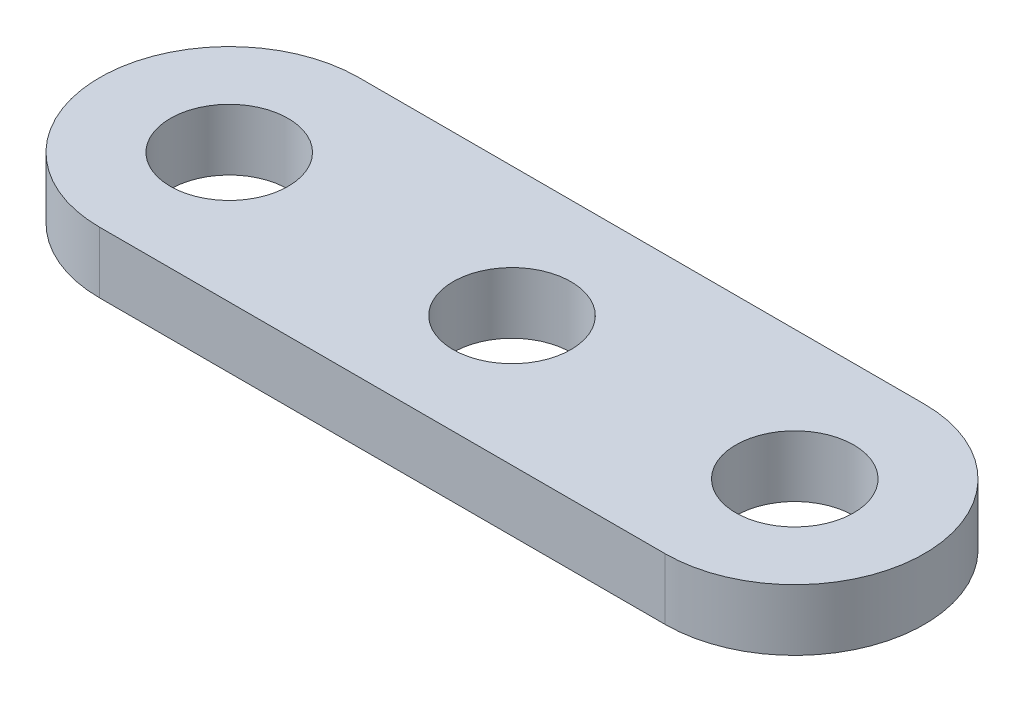
from build123d import *

# Parameters (mm, degrees)
SKETCH_1_R      = 2.5
EXTRUDE_1_DEPTH = 2.6


with BuildPart() as part:
    # 草图1 → 凸台-拉伸1 (new body)
    with BuildSketch(Plane(origin=(0, 0, 0), x_dir=(1, 0, 0), z_dir=(0, 1, 0))):
        with BuildLine():
            Line((-12, 5.5), (12, 5.5))
            ThreePointArc((12, 5.5), (17.5, 0), (12, -5.5))
            Line((12, -5.5), (-12, -5.5))
            ThreePointArc((-12, -5.5), (-17.5, 0), (-12, 5.5))
        make_face()
        with Locations(Location((-12, 0, 0), (0, 0, 270))):
            Circle(SKETCH_1_R, mode=Mode.SUBTRACT)
        with Locations(Location((0, 0, 0), (0, 0, 270))):
            Circle(SKETCH_1_R, mode=Mode.SUBTRACT)
        with Locations(Location((12, 0, 0), (0, 0, 90))):
            Circle(SKETCH_1_R, mode=Mode.SUBTRACT)
    extrude(amount=EXTRUDE_1_DEPTH)


solid = part.part
